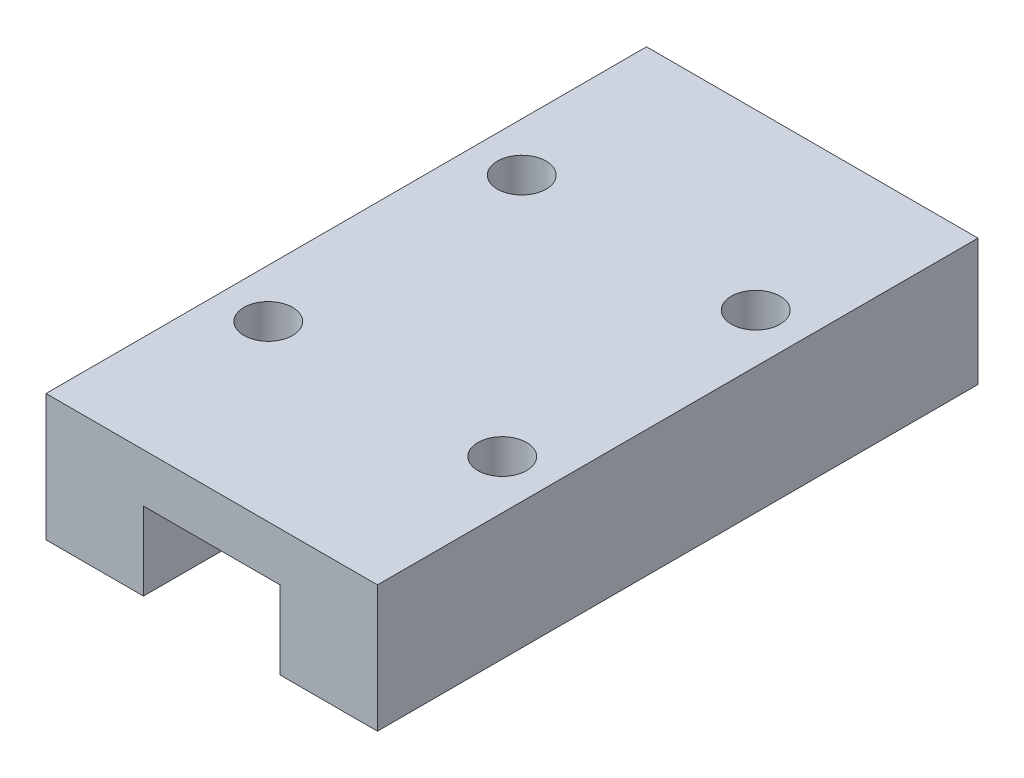
from build123d import *

# Parameters (mm, degrees)
EXTRUDE_1_DEPTH     = 30.8
SKETCH_2_R          = 1.25
CUT_EXTRUDE_1_DEPTH = 22.5


with BuildPart() as part:
    # 草图1 → 凸台-拉伸1 (new body)
    with BuildSketch(Plane.XY):
        Polygon((0, 0), (5, 0), (5, 4), (12, 4), (12, 0), (17, 0), (17, 6.5), (0, 6.5), align=None)
    extrude(amount=EXTRUDE_1_DEPTH)

    # 草图2 → 切除-拉伸1 (cut)
    with BuildSketch(Plane(origin=(0, 6.5, 0), x_dir=(1, 0, 0), z_dir=(0, 1, 0))):
        with Locations(Location((14.5, -8.9, 0), (0, 0, 180))):
            Circle(SKETCH_2_R)
        with Locations(Location((14.5, -21.9, 0), (0, 0, 180))):
            Circle(SKETCH_2_R)
        with Locations(Location((2.5, -21.9, 0), (0, 0, 180))):
            Circle(SKETCH_2_R)
        with Locations(Location((2.5, -8.9, 0), (0, 0, 180))):
            Circle(SKETCH_2_R)
    extrude(amount=-CUT_EXTRUDE_1_DEPTH, mode=Mode.SUBTRACT)


solid = part.part
